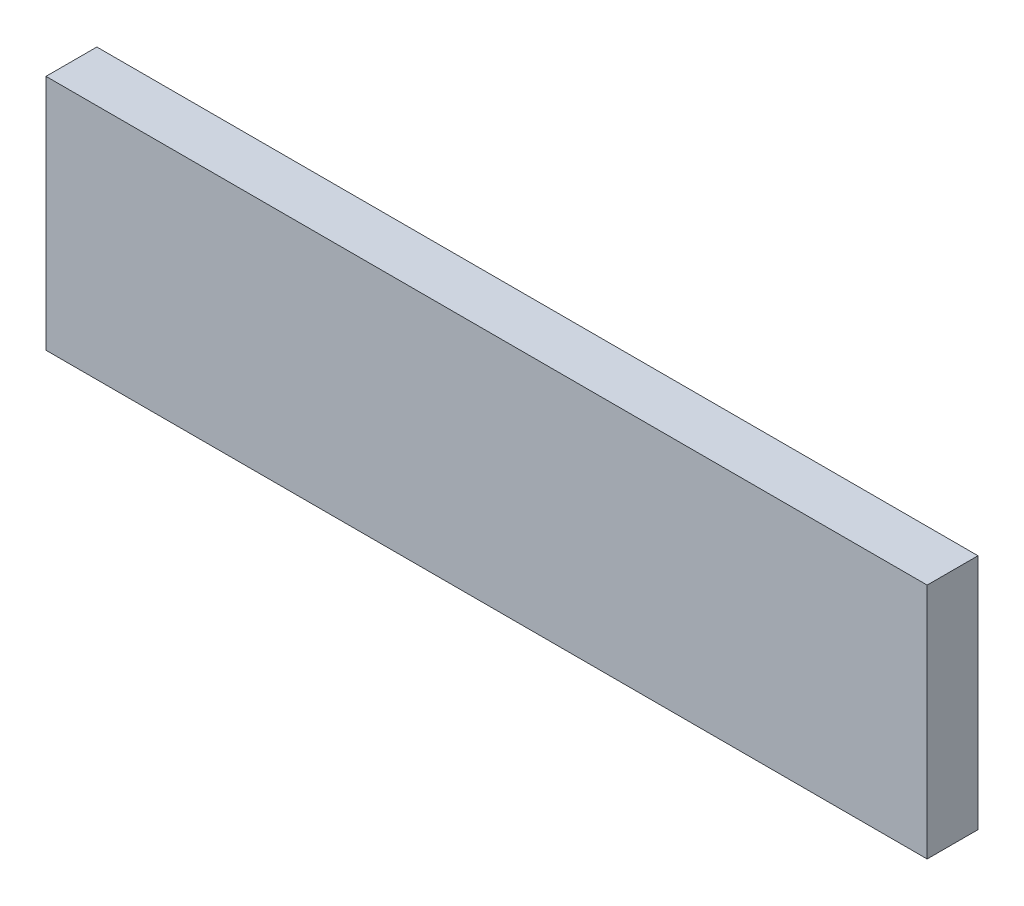
from build123d import *

# Parameters (mm, degrees)
SKETCH1_W           = 52
SKETCH1_H           = 14
BOSS_EXTRUDE1_DEPTH = 3


with BuildPart() as part:
    # Sketch1 → Boss-Extrude1 (new body)
    with BuildSketch(Plane.XY):
        with Locations((84.349715594, 181.193630233)):
            Rectangle(SKETCH1_W, SKETCH1_H)
    extrude(amount=BOSS_EXTRUDE1_DEPTH)


solid = part.part
